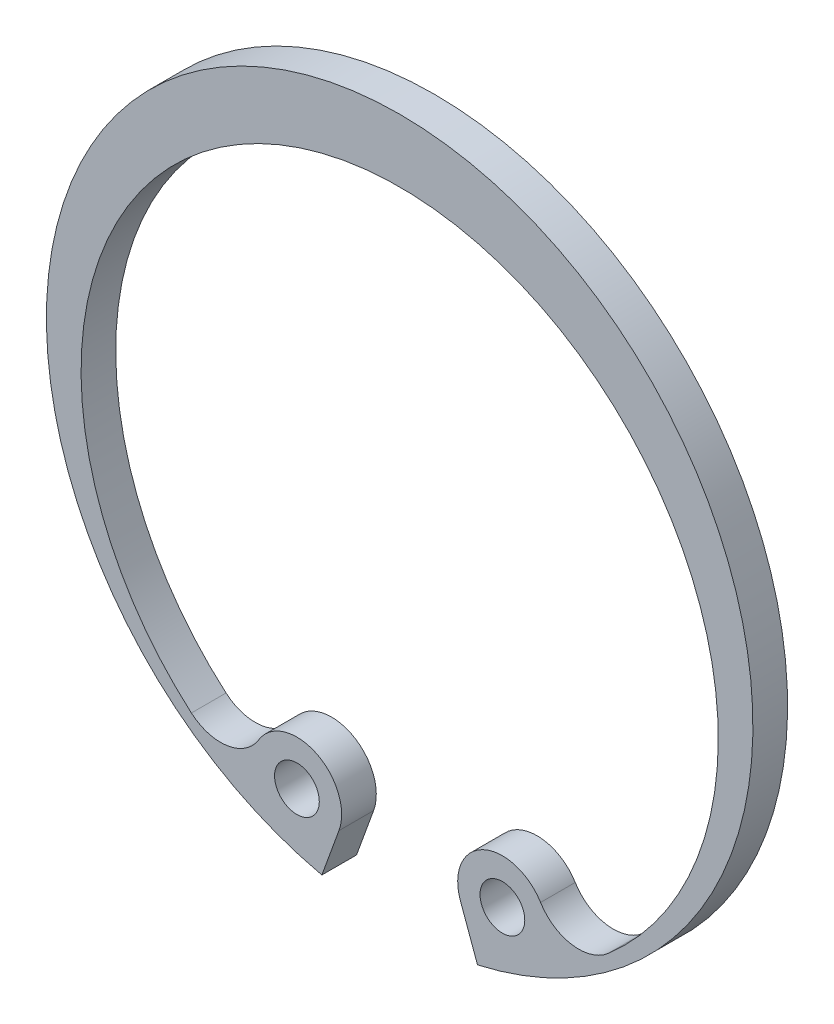
from build123d import *

# Parameters (mm, degrees)
SKETCH1_R                 = 7.9
EXTRUDE1_DEPTH            = 0.775
SKETCH34_R                = 0.5
F_056_250_SNAP_RING_DEPTH = 0.775
SKETCH35_R                = 7.9
CUT_EXTRUDE1_DEPTH        = 0.775


with BuildPart() as part:
    # Sketch1 → Extrude1 (new body)
    with BuildSketch(Plane.XY):
        with Locations(Location((0, 0, 0), (0, 0, 180))):
            Circle(SKETCH1_R)
    extrude(amount=EXTRUDE1_DEPTH)

    # Sketch34 → 056-250 Snap Ring (add)
    with BuildSketch(Plane.XY.offset(0.775)):
        with BuildLine():
            Line((-1.357948468, -6.654737152), (-1.740532253, -7.705877463))
            ThreePointArc((-1.740532253, -7.705877463), (0, 7.9), (1.740532253, -7.705877463))
            Line((1.740532253, -7.705877463), (1.357948468, -6.654737152))
            ThreePointArc((1.357948468, -6.654737152), (1.863757747, -5.411747949), (3.15093243, -5.791282558))
            ThreePointArc((3.15093243, -5.791282558), (3.849974822, -6.257880122), (4.657974592, -6.026558003))
            ThreePointArc((4.657974592, -6.026558003), (0, 6.49), (-4.657974592, -6.026558003))
            ThreePointArc((-4.657974592, -6.026558003), (-3.849974822, -6.257880122), (-3.15093243, -5.791282558))
            ThreePointArc((-3.15093243, -5.791282558), (-1.863757747, -5.411747949), (-1.357948468, -6.654737152))
        make_face()
        with Locations((2.297641088, -6.312717009)):
            Circle(SKETCH34_R, mode=Mode.SUBTRACT)
        with Locations((-2.297641088, -6.312717009)):
            Circle(SKETCH34_R, mode=Mode.SUBTRACT)
    extrude(amount=F_056_250_SNAP_RING_DEPTH)

    # Sketch35 → Cut-Extrude1 (cut)
    with BuildSketch(Plane(origin=(0, 0, 0), x_dir=(-1, 0, 0), z_dir=(0, 0, -1))):
        Circle(SKETCH35_R)
    extrude(amount=-CUT_EXTRUDE1_DEPTH, mode=Mode.SUBTRACT)


solid = part.part
